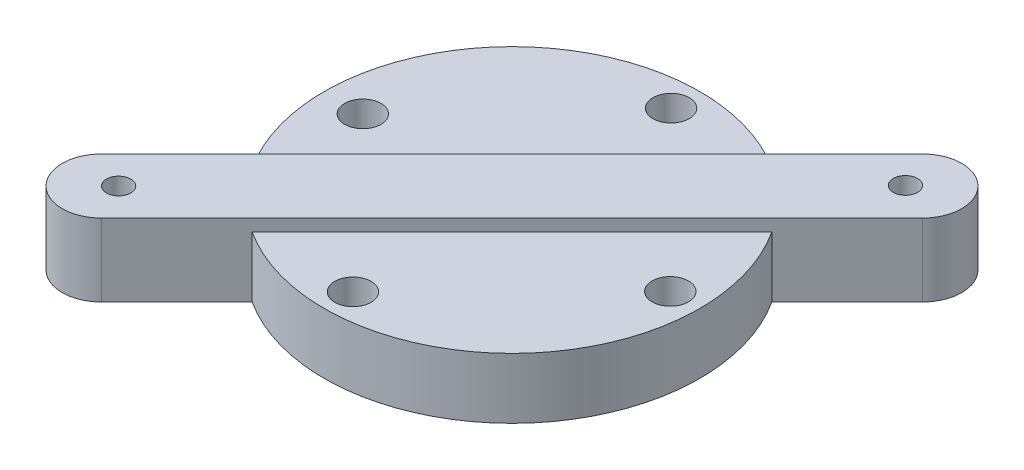
from build123d import *

# Parameters (mm, degrees)
SKETCH6_R           = 31
BOSS_EXTRUDE3_DEPTH = 10
SKETCH7_R           = 3
CUT_EXTRUDE4_DEPTH  = 10
SKETCH8_R           = 2
BOSS_EXTRUDE8_DEPTH = 12


with BuildPart() as part:
    # Sketch6 → Boss-Extrude3 (new body)
    with BuildSketch(Plane(origin=(0, 0, 0), x_dir=(1, 0, 0), z_dir=(0, 1, 0))):
        with Locations(Location((0, 0, 0), (0, 0, 270))):
            Circle(SKETCH6_R)
    extrude(amount=BOSS_EXTRUDE3_DEPTH)

    # Sketch7 → Cut-Extrude4 (cut)
    with BuildSketch(Plane(origin=(0, 0, 0), x_dir=(1, 0, 0), z_dir=(0, 1, 0))):
        with Locations(Location((0, 26.248619222, 0), (0, 0, 270))):
            Circle(SKETCH7_R)
        with Locations(Location((26.123027742, 0, 0), (0, 0, 270))):
            Circle(SKETCH7_R)
        with Locations(Location((-24.615929988, 0, 0), (0, 0, 270))):
            Circle(SKETCH7_R)
        with Locations(Location((0, -26.248619222, 0), (0, 0, 270))):
            Circle(SKETCH7_R)
    extrude(amount=CUT_EXTRUDE4_DEPTH, mode=Mode.SUBTRACT)

    # Sketch8 → Boss-Extrude8 (add)
    with BuildSketch(Plane(origin=(0, 0, 0), x_dir=(1, 0, 0), z_dir=(0, 1, 0))):
        with BuildLine():
            Line((-38.449006602, -29.291772781), (29.291772781, 38.449006602))
            ThreePointArc((29.291772781, 38.449006602), (38.449006602, 38.449006602), (38.449006602, 29.291772781))
            Line((38.449006602, 29.291772781), (-29.291772781, -38.449006602))
            ThreePointArc((-29.291772781, -38.449006602), (-38.449006602, -38.449006602), (-38.449006602, -29.291772781))
        make_face()
        with Locations(Location((32.376246773, 32.540902219, 0), (0, 0, 270))):
            Circle(SKETCH8_R, mode=Mode.SUBTRACT)
        with Locations(Location((-32.456176129, -32.456176129, 0), (0, 0, 270))):
            Circle(SKETCH8_R, mode=Mode.SUBTRACT)
    extrude(amount=BOSS_EXTRUDE8_DEPTH)


solid = part.part
